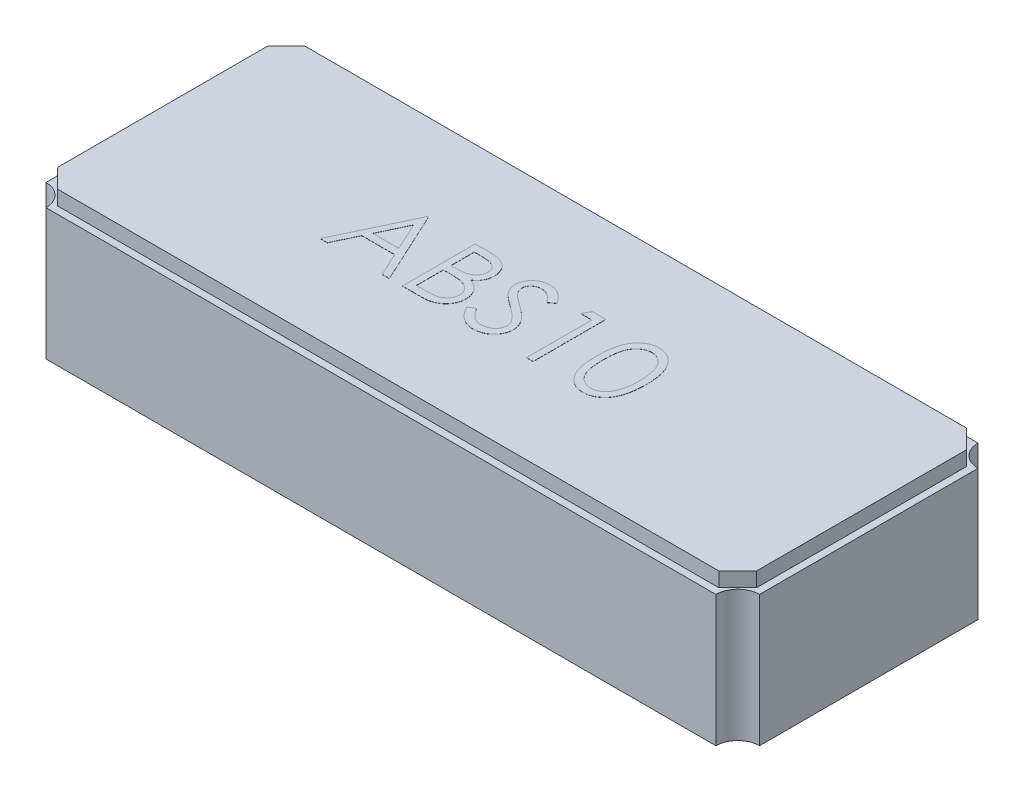
from build123d import *

# Parameters (mm, degrees)
BOSS_EXTRUDE1_DEPTH = 0.9
BOSS_EXTRUDE2_DEPTH = 0.1
BOSS_EXTRUDE3_DEPTH = 0.001
BOSS_EXTRUDE4_DEPTH = 0.001


with BuildPart() as part:
    # Sketch1 → Boss-Extrude1 (new body)
    with BuildSketch(Plane(origin=(0, 0, 0), x_dir=(1, 0, 0), z_dir=(0, 1, 0))):
        with BuildLine():
            Line((-2.3, -0.9), (2.3, -0.9))
            ThreePointArc((2.3, -0.9), (2.343933983, -0.793933983), (2.45, -0.75))
            Line((2.45, -0.75), (2.45, 0.75))
            ThreePointArc((2.45, 0.75), (2.343933983, 0.793933983), (2.3, 0.9))
            Line((2.3, 0.9), (-2.3, 0.9))
            ThreePointArc((-2.3, 0.9), (-2.343933983, 0.793933983), (-2.45, 0.75))
            Line((-2.45, 0.75), (-2.45, -0.75))
            ThreePointArc((-2.45, -0.75), (-2.343933983, -0.793933983), (-2.3, -0.9))
        make_face()
    extrude(amount=BOSS_EXTRUDE1_DEPTH)

    # Sketch2 → Boss-Extrude2 (add)
    with BuildSketch(Plane(origin=(0, 0.9, 0), x_dir=(1, 0, 0), z_dir=(0, 1, 0))):
        Polygon((2.27, 0.85), (2.4, 0.72), (2.4, -0.72), (2.27, -0.85), (-2.27, -0.85), (-2.4, -0.72), (-2.4, 0.72), (-2.27, 0.85), align=None)
    extrude(amount=BOSS_EXTRUDE2_DEPTH)

    # Sketch3 → Boss-Extrude3 (add)
    with BuildSketch(Plane.XZ):
        with BuildLine():
            Line((-2.2, -0.8), (-1.6, -0.8))
            Line((-1.6, -0.8), (-1.6, 0.8))
            Line((-1.6, 0.8), (-2.2, 0.8))
            ThreePointArc((-2.2, 0.8), (-2.243933983, 0.693933983), (-2.35, 0.65))
            Line((-2.35, 0.65), (-2.35, -0.65))
            ThreePointArc((-2.35, -0.65), (-2.243933983, -0.693933983), (-2.2, -0.8))
        make_face()
        with BuildLine():
            Line((1.6, -0.8), (1.6, 0.8))
            Line((1.6, 0.8), (2.2, 0.8))
            ThreePointArc((2.2, 0.8), (2.243933983, 0.693933983), (2.35, 0.65))
            Line((2.35, 0.65), (2.35, -0.65))
            ThreePointArc((2.35, -0.65), (2.243933983, -0.693933983), (2.2, -0.8))
            Line((2.2, -0.8), (1.6, -0.8))
        make_face()
    extrude(amount=BOSS_EXTRUDE3_DEPTH)

    # Sketch4 → Boss-Extrude4 (add)
    # profile 1 of 5: a face of its own
    with BuildSketch(Plane(origin=(0, 1, 0), x_dir=(1, 0, 0), z_dir=(0, 1, 0))):
        Polygon((-0.830075123, 0.256999032), (-0.599305892, -0.243000968), (-0.648083937, -0.243000968), (-0.722002206, -0.082744558), (-0.948664866, -0.082744558), (-1.024686501, -0.243000968), (-1.073664866, -0.243000968), (-0.836485379, 0.256999032), align=None)
        Polygon((-0.833781052, 0.159543102), (-0.924325924, -0.031462506), (-0.745640027, -0.031462506), align=None, mode=Mode.SUBTRACT)
    # profile 2 of 5: a face of its own
    with BuildSketch(Plane(origin=(0, 1, 0), x_dir=(1, 0, 0), z_dir=(0, 1, 0))):
        with BuildLine():
            Line((-0.509562302, 0.256999032), (-0.412006213, 0.256999032))
            add(Edge.make_bspline(
                [(-0.412006213, 0.256999032), (-0.407230716, 0.256973925), (-0.397974614, 0.256925261), (-0.384514694, 0.256170528), (-0.371907721, 0.255141432), (-0.360150039, 0.253508562), (-0.349247082, 0.251538308), (-0.339165991, 0.249152334), (-0.329938823, 0.246291389), (-0.318922718, 0.241741921), (-0.306362624, 0.234981468), (-0.292762853, 0.224991673), (-0.281133676, 0.21277275), (-0.271107059, 0.198989513), (-0.263135471, 0.18382726), (-0.257368428, 0.167647376), (-0.253717303, 0.150658556), (-0.253341813, 0.138995244), (-0.253152046, 0.133100795)],
                knots=[0, 0, 0, 0, 1.001505555, 1.941167018, 2.826882275, 3.653841531, 4.429895133, 5.150066043, 5.825578002, 6.45369114, 7.647487171, 8.808567382, 9.977351308, 11.170798116, 12.373658725, 13.556498008, 14.765093433, 16, 16, 16, 16], degree=3))
            add(Edge.make_bspline(
                [(-0.253152046, 0.133100795), (-0.25330822, 0.127579001), (-0.253615117, 0.116728156), (-0.256549797, 0.100857569), (-0.261144178, 0.085750252), (-0.267530642, 0.07146134), (-0.275830927, 0.058313681), (-0.28566783, 0.046201214), (-0.297535944, 0.035636777), (-0.306427836, 0.029730648), (-0.310944514, 0.026730602)],
                knots=[0, 0, 0, 0, 1.044552857, 2.05264487, 3.044412934, 4.028983338, 5.005914585, 5.980388656, 6.974128949, 8, 8, 8, 8], degree=3))
            add(Edge.make_bspline(
                [(-0.310944514, 0.026730602), (-0.305264453, 0.024549888), (-0.294397089, 0.020377642), (-0.279441944, 0.013001147), (-0.266556966, 0.004977989), (-0.255643088, -0.003783704), (-0.246309138, -0.01322782), (-0.238158717, -0.023492837), (-0.231204235, -0.034712659), (-0.225245246, -0.046770307), (-0.220595424, -0.05954266), (-0.217113152, -0.072909913), (-0.215117802, -0.086824135), (-0.214833853, -0.096293475), (-0.214690507, -0.101073885)],
                knots=[0, 0, 0, 0, 1.27268992, 2.434971085, 3.483601985, 4.442670788, 5.356604649, 6.2567628, 7.179492994, 8.113709626, 9.066344395, 10.018646069, 10.999752585, 12, 12, 12, 12], degree=3))
            add(Edge.make_bspline(
                [(-0.214690507, -0.101073885), (-0.214830057, -0.105954866), (-0.215104624, -0.115558335), (-0.217130335, -0.129666211), (-0.220560207, -0.143148346), (-0.225284656, -0.156091944), (-0.231450701, -0.168471963), (-0.238954696, -0.180302429), (-0.247902062, -0.191464477), (-0.257911044, -0.202082137), (-0.269234207, -0.211628964), (-0.281450744, -0.220131208), (-0.294714504, -0.227123502), (-0.308807646, -0.23299722), (-0.323888262, -0.237483962), (-0.339888635, -0.240622901), (-0.356794964, -0.242737907), (-0.368396357, -0.242911793), (-0.374345956, -0.243000968)],
                knots=[0, 0, 0, 0, 0.978564426, 1.925352924, 2.850884081, 3.763762016, 4.682927383, 5.618979971, 6.567305752, 7.547517671, 8.540179244, 9.531824382, 10.526200242, 11.540722885, 12.589160233, 13.674978461, 14.80764778, 16, 16, 16, 16], degree=3))
            Line((-0.374345956, -0.243000968), (-0.509562302, -0.243000968))
            Line((-0.509562302, -0.243000968), (-0.509562302, 0.256999032))
        make_face()
        with BuildLine():
            Line((-0.464690507, 0.205716981), (-0.464690507, 0.04546057))
            Line((-0.464690507, 0.04546057), (-0.43454227, 0.04546057))
            add(Edge.make_bspline(
                [(-0.43454227, 0.04546057), (-0.430135299, 0.045517702), (-0.421620134, 0.045628093), (-0.40928872, 0.045944309), (-0.397842289, 0.046829744), (-0.387300598, 0.047714924), (-0.377680249, 0.049154151), (-0.369002555, 0.050867312), (-0.361131327, 0.052679155), (-0.352054249, 0.055760511), (-0.341758113, 0.060314464), (-0.330781956, 0.067381869), (-0.321105603, 0.075799634), (-0.312934576, 0.085512629), (-0.306247223, 0.096207798), (-0.301602407, 0.107714495), (-0.298452794, 0.119745943), (-0.29816829, 0.128005693), (-0.298023841, 0.132199352)],
                knots=[0, 0, 0, 0, 1.156816544, 2.235205308, 3.236616184, 4.169592532, 5.011045266, 5.787822928, 6.49130361, 7.128639758, 8.301311294, 9.436451833, 10.541879658, 11.654887649, 12.756523258, 13.837046038, 14.901820046, 16, 16, 16, 16], degree=3))
            add(Edge.make_bspline(
                [(-0.298023841, 0.132199352), (-0.298099009, 0.134974463), (-0.298246461, 0.140418144), (-0.299454075, 0.148353766), (-0.301506586, 0.15581716), (-0.304142914, 0.162910604), (-0.307827012, 0.169412297), (-0.31216465, 0.175547039), (-0.317405463, 0.181105913), (-0.323370793, 0.186301556), (-0.330229168, 0.190907917), (-0.337976495, 0.194942312), (-0.346717592, 0.198190994), (-0.356305142, 0.201036159), (-0.366886726, 0.203034486), (-0.378340234, 0.204699256), (-0.39075948, 0.205546791), (-0.399351637, 0.205658985), (-0.403793071, 0.205716981)],
                knots=[0, 0, 0, 0, 0.91205012, 1.789085906, 2.630437955, 3.453916878, 4.269457761, 5.079663411, 5.91843418, 6.774407191, 7.675494373, 8.627863946, 9.638891023, 10.736472738, 11.911756761, 13.175263542, 14.539845004, 16, 16, 16, 16], degree=3))
            Line((-0.403793071, 0.205716981), (-0.464690507, 0.205716981))
        make_face(mode=Mode.SUBTRACT)
        with BuildLine():
            Line((-0.464690507, -0.005821481), (-0.464690507, -0.191718917))
            Line((-0.464690507, -0.191718917), (-0.400788264, -0.191718917))
            add(Edge.make_bspline(
                [(-0.400788264, -0.191718917), (-0.396214132, -0.191664096), (-0.387398095, -0.191558435), (-0.374669347, -0.191213499), (-0.362871761, -0.190428888), (-0.35205917, -0.189193767), (-0.34211482, -0.187853988), (-0.333158005, -0.186052377), (-0.32511612, -0.18398824), (-0.315791219, -0.180797644), (-0.305290718, -0.175841005), (-0.293974882, -0.168367544), (-0.283913993, -0.159464214), (-0.275370385, -0.149159798), (-0.268368529, -0.137955323), (-0.263274893, -0.126077415), (-0.260133342, -0.11372234), (-0.259753032, -0.105298524), (-0.259562302, -0.101073885)],
                knots=[0, 0, 0, 0, 1.160039823, 2.235823828, 3.228722157, 4.157150951, 4.99529583, 5.772374946, 6.472645482, 7.099169577, 8.269452708, 9.405989375, 10.527446681, 11.663510218, 12.788923519, 13.866172445, 14.929861265, 16, 16, 16, 16], degree=3))
            add(Edge.make_bspline(
                [(-0.259562302, -0.101073885), (-0.259601746, -0.098431979), (-0.259679996, -0.093190782), (-0.260860084, -0.085488522), (-0.262576351, -0.078027683), (-0.264795128, -0.070788005), (-0.26802648, -0.06390038), (-0.271798844, -0.057228586), (-0.276221901, -0.050763803), (-0.283113925, -0.042590624), (-0.293138494, -0.033173908), (-0.307382319, -0.023954265), (-0.323578362, -0.016518864), (-0.335325146, -0.013361796), (-0.341393232, -0.011730936)],
                knots=[0, 0, 0, 0, 0.723448775, 1.435228256, 2.130040452, 2.821711965, 3.505591119, 4.210454504, 4.921174351, 5.648778258, 7.137944449, 8.670945889, 10.280296675, 12, 12, 12, 12], degree=3))
            add(Edge.make_bspline(
                [(-0.341393232, -0.011730936), (-0.34382596, -0.011237353), (-0.349100616, -0.010167162), (-0.357701699, -0.00903749), (-0.367521109, -0.008031053), (-0.37858152, -0.007286602), (-0.390896925, -0.006517096), (-0.404493628, -0.006217835), (-0.419316102, -0.005860798), (-0.429600726, -0.005834922), (-0.434942911, -0.005821481)],
                knots=[0, 0, 0, 0, 0.634451884, 1.375622551, 2.216452059, 3.157844607, 4.20941857, 5.370758133, 6.634282058, 8, 8, 8, 8], degree=3))
            Line((-0.434942911, -0.005821481), (-0.464690507, -0.005821481))
        make_face(mode=Mode.SUBTRACT)
    # profile 3 of 5: a face of its own
    with BuildSketch(Plane(origin=(0, 1, 0), x_dir=(1, 0, 0), z_dir=(0, 1, 0))):
        with BuildLine():
            Line((-0.163408456, -0.146546641), (-0.121140828, -0.121206096))
            add(Edge.make_bspline(
                [(-0.121140828, -0.121206096), (-0.117209651, -0.127786723), (-0.109677668, -0.140394949), (-0.097113188, -0.157431812), (-0.084094201, -0.17191212), (-0.070524296, -0.183751635), (-0.056486304, -0.193072905), (-0.041888582, -0.199673224), (-0.026780323, -0.203789792), (-0.016498349, -0.204289804), (-0.011365187, -0.20453943)],
                knots=[0, 0, 0, 0, 1.272034388, 2.437168799, 3.508375237, 4.49857839, 5.41946034, 6.295179144, 7.148887113, 8, 8, 8, 8], degree=3))
            add(Edge.make_bspline(
                [(-0.011365187, -0.20453943), (-0.00698135, -0.204417333), (0.001709618, -0.204175278), (0.014504224, -0.201849449), (0.026930196, -0.198276288), (0.03873143, -0.193159012), (0.049745089, -0.186967799), (0.059403188, -0.179489774), (0.067752633, -0.171117459), (0.074582507, -0.16177708), (0.079822512, -0.151731773), (0.08384995, -0.141420923), (0.08608496, -0.130682556), (0.08642164, -0.12345249), (0.086591544, -0.119803853)],
                knots=[0, 0, 0, 0, 1.095163259, 2.171163733, 3.241058638, 4.321873601, 5.38011039, 6.391990106, 7.366004449, 8.327778327, 9.272591725, 10.192022065, 11.087607919, 12, 12, 12, 12], degree=3))
            add(Edge.make_bspline(
                [(0.086591544, -0.119803853), (0.086380928, -0.115640874), (0.085952777, -0.107178147), (0.082333994, -0.094692482), (0.076641244, -0.082336401), (0.071389438, -0.074693363), (0.068662858, -0.070725327)],
                knots=[0, 0, 0, 0, 0.938893495, 1.908633276, 2.914225137, 4, 4, 4, 4], degree=3))
            add(Edge.make_bspline(
                [(0.068662858, -0.070725327), (0.066424199, -0.067861495), (0.061724414, -0.061849238), (0.053644769, -0.052899919), (0.044163896, -0.043668716), (0.033606245, -0.033803136), (0.021587232, -0.023762023), (0.008483302, -0.013066554), (-0.006040107, -0.002123472), (-0.016225749, 0.005215466), (-0.021481373, 0.009002237)],
                knots=[0, 0, 0, 0, 0.722233717, 1.516239348, 2.393582979, 3.351407094, 4.387010283, 5.505090956, 6.712668013, 8, 8, 8, 8], degree=3))
            add(Edge.make_bspline(
                [(-0.021481373, 0.009002237), (-0.026741944, 0.012749178), (-0.036799755, 0.019913044), (-0.050865266, 0.030545085), (-0.063443047, 0.040265638), (-0.074477192, 0.049166211), (-0.083962849, 0.057248011), (-0.091974765, 0.064433431), (-0.098308844, 0.070916797), (-0.10183107, 0.075122703), (-0.103412463, 0.077011051)],
                knots=[0, 0, 0, 0, 1.452282411, 2.77665338, 3.964542531, 5.026858415, 5.96415736, 6.766646006, 7.446254459, 8, 8, 8, 8], degree=3))
            add(Edge.make_bspline(
                [(-0.103412463, 0.077011051), (-0.105622826, 0.079954056), (-0.109969803, 0.085741871), (-0.115707804, 0.09478828), (-0.120584827, 0.104048746), (-0.124408017, 0.113548155), (-0.127627477, 0.123153145), (-0.129792896, 0.132989037), (-0.131148809, 0.143011697), (-0.131287665, 0.149756483), (-0.131357174, 0.153132846)],
                knots=[0, 0, 0, 0, 1.068054152, 2.10047183, 3.106115577, 4.101338837, 5.06977816, 6.043150881, 7.020423561, 8, 8, 8, 8], degree=3))
            add(Edge.make_bspline(
                [(-0.131357174, 0.153132846), (-0.131170716, 0.158422814), (-0.130801784, 0.16888968), (-0.12768171, 0.184179799), (-0.122757011, 0.198777858), (-0.115857742, 0.212539335), (-0.106963834, 0.225105903), (-0.096671552, 0.236622116), (-0.084412768, 0.246303342), (-0.070962393, 0.254762207), (-0.056240055, 0.261383054), (-0.040812783, 0.266377479), (-0.024656058, 0.269207373), (-0.013712753, 0.269613483), (-0.008160059, 0.269819545)],
                knots=[0, 0, 0, 0, 1.005424448, 1.989358655, 2.955360095, 3.929531133, 4.905563448, 5.876582895, 6.856512386, 7.866279853, 8.892233794, 9.918561126, 10.94386622, 12, 12, 12, 12], degree=3))
            add(Edge.make_bspline(
                [(-0.008160059, 0.269819545), (-0.002268044, 0.269616323), (0.009449292, 0.26921218), (0.026684894, 0.265698247), (0.043279282, 0.259883865), (0.05662832, 0.253285486), (0.067075857, 0.246695283), (0.07504339, 0.240692451), (0.083117312, 0.233781722), (0.091362748, 0.225944686), (0.099639985, 0.217109436), (0.108071907, 0.207336481), (0.116678231, 0.196685544), (0.122214783, 0.189082044), (0.125053082, 0.185184128)],
                knots=[0, 0, 0, 0, 1.286793592, 2.559021753, 3.825965368, 5.121522368, 5.803751409, 6.523245864, 7.299691795, 8.125521123, 9.008227632, 9.944561021, 10.946284179, 12, 12, 12, 12], degree=3))
            Line((0.125053082, 0.185184128), (0.084488179, 0.154434929))
            add(Edge.make_bspline(
                [(0.084488179, 0.154434929), (0.08203876, 0.157590457), (0.077321751, 0.163667264), (0.070160396, 0.172177452), (0.063410589, 0.179951235), (0.056760532, 0.186703396), (0.050561442, 0.192803701), (0.044544722, 0.198026523), (0.038796957, 0.202423037), (0.031551684, 0.207114974), (0.022449153, 0.211765903), (0.011022791, 0.215701486), (-0.000918106, 0.218066495), (-0.00905091, 0.218379193), (-0.013168071, 0.218537494)],
                knots=[0, 0, 0, 0, 1.181633172, 2.275549214, 3.290209073, 4.226197932, 5.078386478, 5.862611352, 6.581680152, 7.217281963, 8.414376989, 9.595101626, 10.782541182, 12, 12, 12, 12], degree=3))
            add(Edge.make_bspline(
                [(-0.013168071, 0.218537494), (-0.018333289, 0.218364394), (-0.028293924, 0.218030586), (-0.042435387, 0.214384874), (-0.05516309, 0.208644609), (-0.066099171, 0.200599612), (-0.075204453, 0.191068041), (-0.081790947, 0.180099633), (-0.085755257, 0.167987862), (-0.086239011, 0.159539054), (-0.086485379, 0.155236211)],
                knots=[0, 0, 0, 0, 1.14458467, 2.207223713, 3.21896685, 4.227309161, 5.202851033, 6.127160689, 7.046193047, 8, 8, 8, 8], degree=3))
            add(Edge.make_bspline(
                [(-0.086485379, 0.155236211), (-0.086429218, 0.152557429), (-0.086316805, 0.147195483), (-0.084748976, 0.139273851), (-0.082734786, 0.131372232), (-0.079542982, 0.123526148), (-0.07513651, 0.115598383), (-0.069350056, 0.10745242), (-0.06206244, 0.099016462), (-0.05648001, 0.093529694), (-0.053532655, 0.090632846)],
                knots=[0, 0, 0, 0, 0.858281714, 1.717966888, 2.583508476, 3.4729293, 4.427298488, 5.488583878, 6.674047936, 8, 8, 8, 8], degree=3))
            add(Edge.make_bspline(
                [(-0.053532655, 0.090632846), (-0.052438173, 0.089656128), (-0.049837935, 0.08733567), (-0.045084231, 0.083536773), (-0.038806689, 0.078850662), (-0.031169231, 0.073052474), (-0.022031037, 0.066326551), (-0.0113911, 0.058758892), (0.000631976, 0.050103827), (0.009163678, 0.044052749), (0.013674877, 0.040853199)],
                knots=[0, 0, 0, 0, 0.420754252, 0.999615792, 1.744751191, 2.668019286, 3.750313428, 4.999500688, 6.413464383, 8, 8, 8, 8], degree=3))
            add(Edge.make_bspline(
                [(0.013674877, 0.040853199), (0.019101436, 0.036904433), (0.029609216, 0.029258196), (0.044560299, 0.017770241), (0.058116557, 0.006534846), (0.070325586, -0.004376241), (0.081308001, -0.014880254), (0.090941962, -0.025103566), (0.09932563, -0.034972933), (0.108351233, -0.047626158), (0.117573778, -0.063166313), (0.125493994, -0.082206062), (0.130488043, -0.101319822), (0.131141117, -0.114166513), (0.131463339, -0.120504974)],
                knots=[0, 0, 0, 0, 1.163667725, 2.253281268, 3.268753668, 4.215851969, 5.092017293, 5.902905408, 6.650798638, 7.335211899, 8.59617414, 9.77448103, 10.901945474, 12, 12, 12, 12], degree=3))
            add(Edge.make_bspline(
                [(0.131463339, -0.120504974), (0.131369462, -0.124987598), (0.131183531, -0.133865796), (0.129046258, -0.146902235), (0.125914877, -0.159563788), (0.121195272, -0.171693947), (0.115434821, -0.183514627), (0.108125357, -0.194715756), (0.099652831, -0.205545241), (0.089933721, -0.215714312), (0.079298592, -0.225049483), (0.068058065, -0.233353634), (0.05619374, -0.24027768), (0.04376998, -0.245927801), (0.030783932, -0.250346875), (0.017239963, -0.253548713), (0.003115747, -0.255513815), (-0.006484321, -0.255717781), (-0.011365187, -0.255821481)],
                knots=[0, 0, 0, 0, 0.983748083, 1.948392443, 2.894712957, 3.844097841, 4.80183111, 5.778335162, 6.776009319, 7.81870978, 8.863265674, 9.881300176, 10.883814829, 11.87499822, 12.874611388, 13.892143829, 14.928324115, 16, 16, 16, 16], degree=3))
            add(Edge.make_bspline(
                [(-0.011365187, -0.255821481), (-0.015141664, -0.255748455), (-0.022647059, -0.255603323), (-0.033748413, -0.254320283), (-0.044625497, -0.252504982), (-0.055141823, -0.249622972), (-0.065432882, -0.246126261), (-0.075453916, -0.241820785), (-0.085209781, -0.236661185), (-0.09475515, -0.230761896), (-0.104065746, -0.223896504), (-0.113054241, -0.21590029), (-0.122015554, -0.206993789), (-0.130685182, -0.196935137), (-0.139238488, -0.18588684), (-0.147506832, -0.173745528), (-0.155661363, -0.160577334), (-0.160777859, -0.151310893), (-0.163408456, -0.146546641)],
                knots=[0, 0, 0, 0, 0.915332311, 1.819136955, 2.706846663, 3.586547465, 4.459518054, 5.340707479, 6.227863349, 7.133153174, 8.059268498, 9.028702269, 10.047606654, 11.120612155, 12.245963614, 13.433783089, 14.680604001, 16, 16, 16, 16], degree=3))
        make_face()
    # profile 4 of 5: a face of its own
    with BuildSketch(Plane(origin=(0, 1, 0), x_dir=(1, 0, 0), z_dir=(0, 1, 0))):
        Polygon((0.295425679, 0.256999032), (0.387873595, 0.256999032), (0.387873595, -0.243000968), (0.3430018, -0.243000968), (0.3430018, 0.205716981), (0.266078723, 0.205716981), align=None)
    # profile 5 of 5: a face of its own
    with BuildSketch(Plane(origin=(0, 1, 0), x_dir=(1, 0, 0), z_dir=(0, 1, 0))):
        with BuildLine():
            add(Edge.make_bspline(
                [(0.573771031, 0.006798711), (0.573817891, 0.014812624), (0.573908917, 0.030379765), (0.574921548, 0.053063285), (0.57660374, 0.074343326), (0.578909079, 0.094220907), (0.581714505, 0.112701159), (0.585459574, 0.129734696), (0.589718546, 0.145400354), (0.59465461, 0.159749218), (0.600224294, 0.172974604), (0.606286331, 0.185321061), (0.613081302, 0.196769909), (0.620220861, 0.207503879), (0.627994014, 0.217347264), (0.636179555, 0.226439073), (0.645096966, 0.23456918), (0.65444311, 0.241975795), (0.664302605, 0.248468576), (0.674394414, 0.254187539), (0.684788001, 0.259073234), (0.695511741, 0.262914725), (0.70646925, 0.266087703), (0.717698831, 0.268257553), (0.729219026, 0.269622826), (0.736994945, 0.26975335), (0.740938499, 0.269819545)],
                knots=[0, 0, 0, 0, 1.646270934, 3.197905019, 4.663502075, 6.030701355, 7.308322542, 8.50163776, 9.611534131, 10.641858119, 11.616356847, 12.558055219, 13.465016945, 14.349605745, 15.204443733, 16.039544428, 16.859896111, 17.680448484, 18.487036065, 19.28249412, 20.06191084, 20.843045899, 21.620316918, 22.403196591, 23.190181807, 24, 24, 24, 24], degree=3))
            add(Edge.make_bspline(
                [(0.740938499, 0.269819545), (0.744914996, 0.269749857), (0.752822997, 0.26961127), (0.764514479, 0.268279278), (0.775935862, 0.266069117), (0.787038454, 0.26293755), (0.797913452, 0.259052453), (0.808475796, 0.254182865), (0.818791093, 0.248514455), (0.82869542, 0.241853901), (0.838297508, 0.234427862), (0.847361503, 0.226033195), (0.855888229, 0.216754664), (0.863984701, 0.20669154), (0.871421215, 0.195650814), (0.878503134, 0.183824512), (0.884841996, 0.171005817), (0.89094695, 0.157408608), (0.896216519, 0.142656656), (0.90096884, 0.126833119), (0.904808693, 0.109751092), (0.90800716, 0.0915002), (0.910485003, 0.072013417), (0.912289666, 0.051332515), (0.913242964, 0.029443888), (0.913422492, 0.01447848), (0.913514621, 0.006798711)],
                knots=[0, 0, 0, 0, 0.810914788, 1.612654377, 2.396697861, 3.181598691, 3.963628158, 4.749916497, 5.551656086, 6.361998678, 7.18212741, 8.025565596, 8.878627764, 9.750805457, 10.657531673, 11.591944965, 12.560506719, 13.57287815, 14.630710178, 15.753379473, 16.941251878, 18.199788006, 19.531962791, 20.947069417, 22.433333509, 24, 24, 24, 24], degree=3))
            add(Edge.make_bspline(
                [(0.913514621, 0.006798711), (0.913421537, -0.000847561), (0.913240168, -0.015746011), (0.912300353, -0.037536151), (0.91044912, -0.0581073), (0.908133407, -0.077508794), (0.904926127, -0.095659883), (0.900982531, -0.112623375), (0.896603914, -0.128472529), (0.891198943, -0.143077502), (0.885283127, -0.156642033), (0.878846671, -0.169308769), (0.871950981, -0.181189668), (0.864438304, -0.192189632), (0.856430673, -0.202386583), (0.847756703, -0.211600529), (0.838660905, -0.220053482), (0.82903056, -0.227575143), (0.818971767, -0.234158687), (0.808691899, -0.240046379), (0.798008559, -0.244793907), (0.787163851, -0.248870342), (0.776002656, -0.251984692), (0.764538886, -0.2541381), (0.752830852, -0.255648364), (0.744916343, -0.255763575), (0.740938499, -0.255821481)],
                knots=[0, 0, 0, 0, 1.561518951, 3.042555995, 4.452378317, 5.7783523, 7.031515105, 8.214008947, 9.334062868, 10.386615937, 11.391082383, 12.354592575, 13.286541444, 14.194233754, 15.072674879, 15.931287219, 16.775624067, 17.606195743, 18.42308326, 19.229000347, 20.022332153, 20.807536673, 21.593273796, 22.3848459, 23.188221202, 24, 24, 24, 24], degree=3))
            add(Edge.make_bspline(
                [(0.740938499, -0.255821481), (0.736995054, -0.255754859), (0.729219351, -0.255623493), (0.717697576, -0.254264388), (0.706514369, -0.252079316), (0.695614547, -0.249019801), (0.684942188, -0.245274825), (0.674642719, -0.240395727), (0.664601621, -0.234776574), (0.654845684, -0.228377228), (0.645558233, -0.221045559), (0.636687003, -0.212936375), (0.628454858, -0.203847317), (0.620792844, -0.193921899), (0.613510832, -0.183251436), (0.60681235, -0.17169024), (0.600616513, -0.159284152), (0.594953158, -0.145953022), (0.58993192, -0.131502318), (0.585496533, -0.115766721), (0.581994511, -0.098607345), (0.578996945, -0.080162007), (0.576579176, -0.060351445), (0.574928559, -0.039164906), (0.573908371, -0.01661559), (0.573817646, -0.001148479), (0.573771031, 0.006798711)],
                knots=[0, 0, 0, 0, 0.810891512, 1.598919785, 2.382837074, 3.152667961, 3.926044502, 4.706494248, 5.493654104, 6.291793342, 7.103789334, 7.925228297, 8.761435821, 9.622817696, 10.50288917, 11.416980706, 12.369136599, 13.353924996, 14.394355917, 15.514179734, 16.714354668, 17.994756427, 19.357759367, 20.818452758, 22.365282078, 24, 24, 24, 24], degree=3))
        make_face()
        with BuildLine():
            add(Edge.make_bspline(
                [(0.618642826, 0.006999032), (0.61865989, 0.000320646), (0.618693007, -0.012640789), (0.619558179, -0.03147554), (0.620736784, -0.04904273), (0.622256969, -0.065364664), (0.624514533, -0.080386094), (0.627044074, -0.094210335), (0.630122373, -0.106764226), (0.633764518, -0.118133913), (0.63791296, -0.128512351), (0.642442369, -0.138169668), (0.647308187, -0.147219944), (0.65275378, -0.155581888), (0.658684503, -0.163282769), (0.664966397, -0.170458888), (0.671833909, -0.176858457), (0.681334444, -0.184533722), (0.693876798, -0.192465026), (0.70967972, -0.199371611), (0.72591807, -0.203711962), (0.736939677, -0.204263927), (0.742440903, -0.20453943)],
                knots=[0, 0, 0, 0, 1.459021318, 2.831673884, 4.118529203, 5.306027144, 6.411944654, 7.436330062, 8.375795394, 9.233974572, 10.042671642, 10.816086306, 11.563610507, 12.285937304, 12.993564865, 13.685989202, 14.367179055, 15.041617293, 16.353048772, 17.594441528, 18.799311195, 20, 20, 20, 20], degree=3))
            add(Edge.make_bspline(
                [(0.742440903, -0.20453943), (0.747977713, -0.204311175), (0.759039902, -0.203855138), (0.775201873, -0.199455318), (0.790891911, -0.192816812), (0.803187903, -0.184967169), (0.812542552, -0.177491693), (0.819244979, -0.171118172), (0.8253967, -0.163981619), (0.831231282, -0.15628172), (0.836582579, -0.147871365), (0.841448742, -0.138790997), (0.84588922, -0.1290154), (0.848419083, -0.122191152), (0.849712537, -0.11870209)],
                knots=[0, 0, 0, 0, 1.353760809, 2.704726607, 4.075137775, 5.516104923, 6.260822281, 7.007110065, 7.778089737, 8.566572457, 9.372053459, 10.217411131, 11.088608312, 12, 12, 12, 12], degree=3))
            add(Edge.make_bspline(
                [(0.849712537, -0.11870209), (0.851219933, -0.114240698), (0.854280592, -0.105182161), (0.858225131, -0.09113021), (0.861331617, -0.076386958), (0.864126383, -0.061040513), (0.866033963, -0.044977699), (0.867569365, -0.028248215), (0.868473748, -0.010839449), (0.868585856, 0.000988407), (0.868642826, 0.006999032)],
                knots=[0, 0, 0, 0, 0.884706709, 1.796334032, 2.740027952, 3.714592787, 4.726048262, 5.777819803, 6.87074269, 8, 8, 8, 8], degree=3))
            add(Edge.make_bspline(
                [(0.868642826, 0.006999032), (0.868564227, 0.013008685), (0.868410472, 0.024764852), (0.86782276, 0.041981735), (0.866305106, 0.058334272), (0.864619518, 0.073892911), (0.8621342, 0.088571525), (0.859454514, 0.102492998), (0.85585434, 0.115484858), (0.852008658, 0.127750513), (0.847607173, 0.139150606), (0.842762068, 0.14973829), (0.837587531, 0.159564679), (0.831967211, 0.168602814), (0.825967828, 0.176893177), (0.819431035, 0.184269548), (0.812616125, 0.190960543), (0.803070813, 0.198598053), (0.790574486, 0.206385438), (0.775025107, 0.213551975), (0.758843587, 0.217667446), (0.747904522, 0.218247687), (0.742440903, 0.218537494)],
                knots=[0, 0, 0, 0, 1.31362396, 2.569729283, 3.763502607, 4.902122613, 5.988968491, 7.01645872, 7.998833611, 8.933434873, 9.825090667, 10.667526885, 11.477055099, 12.250526234, 12.991942729, 13.710640831, 14.402115721, 15.076753259, 16.378508321, 17.609869233, 18.806226677, 20, 20, 20, 20], degree=3))
            add(Edge.make_bspline(
                [(0.742440903, 0.218537494), (0.736910818, 0.218247287), (0.725840575, 0.217666345), (0.709490867, 0.213567309), (0.693818817, 0.206422599), (0.681355534, 0.19857226), (0.671803565, 0.191095359), (0.665077466, 0.184611579), (0.65877087, 0.177519257), (0.652961198, 0.169747555), (0.647519872, 0.16139536), (0.642522585, 0.152396965), (0.638020109, 0.14270677), (0.633865175, 0.132332994), (0.63021192, 0.120964287), (0.627198497, 0.10842586), (0.624414632, 0.094645589), (0.622443879, 0.079542803), (0.620691914, 0.063216781), (0.619566007, 0.045605735), (0.618690113, 0.026739395), (0.618658904, 0.013710944), (0.618642826, 0.006999032)],
                knots=[0, 0, 0, 0, 1.207732386, 2.417664972, 3.655092373, 4.956220595, 5.625982001, 6.301752483, 6.994047911, 7.697131622, 8.419323945, 9.170223765, 9.943494443, 10.752040957, 11.610060368, 12.549350801, 13.567764191, 14.679664412, 15.874934091, 17.154273443, 18.533957287, 20, 20, 20, 20], degree=3))
        make_face(mode=Mode.SUBTRACT)
    extrude(amount=BOSS_EXTRUDE4_DEPTH)


solid = part.part
